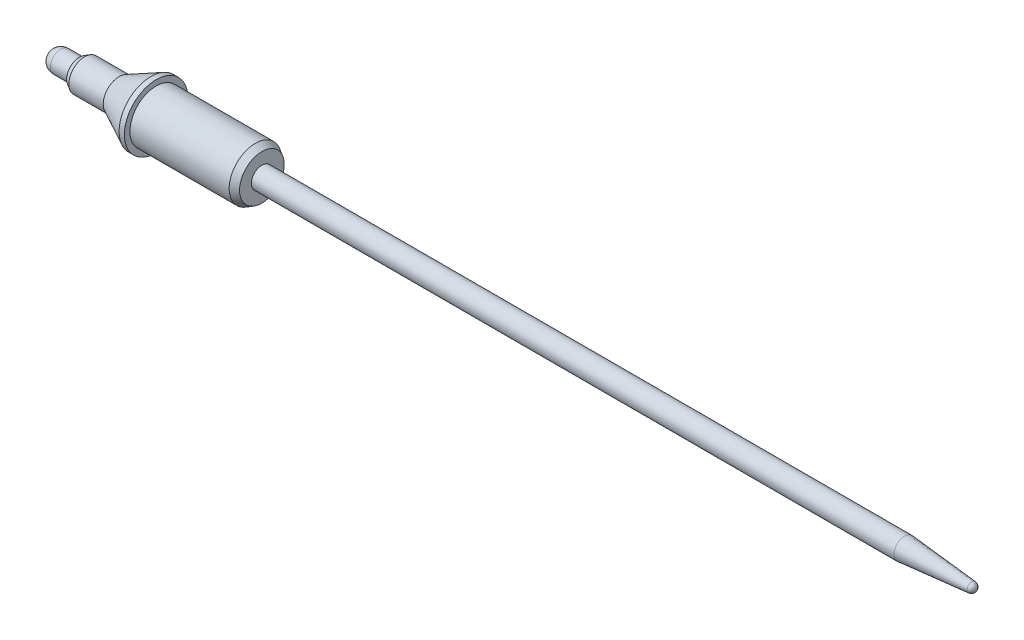
from build123d import *


with BuildPart() as part:
    # Esboço1 → Revolução1 (revolve)
    with BuildSketch(Plane.XY, mode=Mode.PRIVATE) as revolu_o1_sk:
        with BuildLine():
            Line((0, 0.4), (0.7, 0.4))
            Line((0.7, 0.4), (0.7, 0.484529946))
            Line((0.7, 0.484529946), (0.9, 0.6))
            Line((0.9, 0.6), (2.2, 0.6))
            Line((2.2, 0.6), (3.4, 1.2))
            Line((3.4, 1.2), (3.6, 1.2))
            Line((3.6, 1.2), (3.6, 0.99))
            Line((3.6, 0.99), (7.35, 0.99))
            Line((7.35, 0.99), (7.6, 0.845662433))
            Line((7.6, 0.845662433), (7.6, 0.4))
            Line((7.6, 0.4), (31.895599944, 0.4))
            Line((31.895599944, 0.4), (34.437226116, 0.177636523))
            ThreePointArc((34.437226116, 0.177636523), (34.553152591, 0.120467912), (34.6, 0))
            Line((34.6, 0), (-0.4, 0))
            ThreePointArc((-0.4, 0), (-0.282842712, 0.282842712), (0, 0.4))
        make_face()
    revolve(revolu_o1_sk.sketch.rotate(Axis((-0.4, 0, 0), (1, 0, 0)), 90), axis=Axis((-0.4, 0, 0), (1, 0, 0)))


solid = part.part
